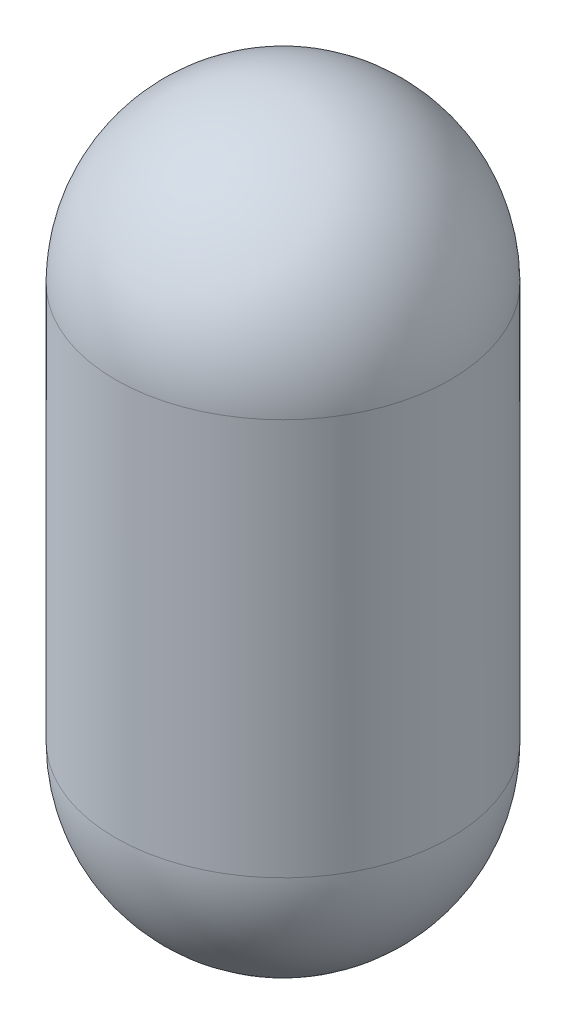
from build123d import *


with BuildPart() as part:
    # Sketch1 → Revolve3 (revolve)
    with BuildSketch(Plane.XY, mode=Mode.PRIVATE) as revolve3_sk:
        with BuildLine():
            Line((-74.295, 87.9475), (-74.295, -87.9475))
            ThreePointArc((-74.295, -87.9475), (-52.534498308, -140.481998308), (0, -162.2425))
            Line((0, -162.2425), (0, -159.0675))
            ThreePointArc((0, -159.0675), (-50.289434278, -138.236934278), (-71.12, -87.9475))
            Line((-71.12, -87.9475), (-71.12, 87.9475))
            ThreePointArc((-71.12, 87.9475), (-50.289434278, 138.236934278), (0, 159.0675))
            Line((0, 159.0675), (0, 162.2425))
            ThreePointArc((0, 162.2425), (-52.534498308, 140.481998308), (-74.295, 87.9475))
        make_face()
    revolve(revolve3_sk.sketch.rotate(Axis((0, 87.9475, 0), (0, -1, 0)), 270), axis=Axis((0, 87.9475, 0), (0, -1, 0)))


solid = part.part
